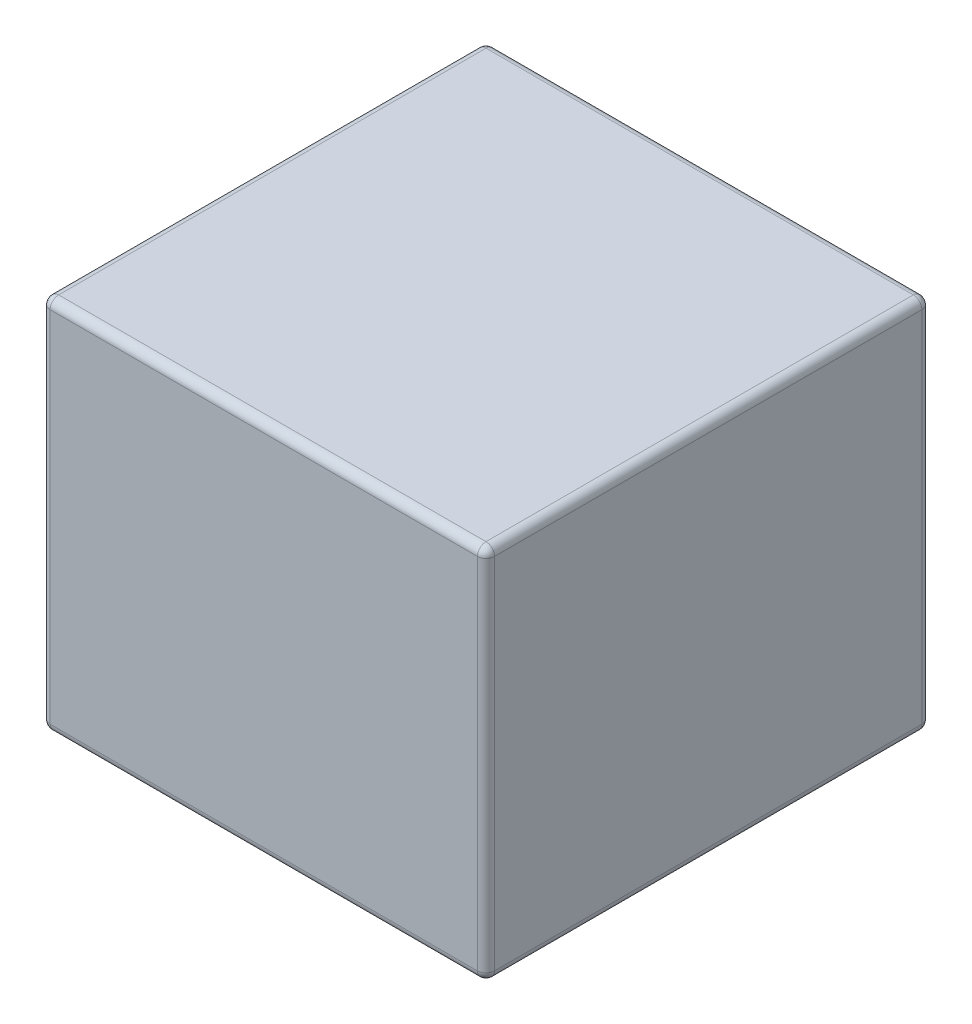
from build123d import *

# Parameters (mm, degrees)
SKETCH1_W           = 330.2
SKETCH1_H           = 330.2
BOSS_EXTRUDE1_DEPTH = 279.4
FILLET1_R           = 6.35


with BuildPart() as part:
    # Sketch1 → Boss-Extrude1 (new body)
    with BuildSketch(Plane(origin=(0, 0, 0), x_dir=(1, 0, 0), z_dir=(0, 1, 0))):
        Rectangle(SKETCH1_W, SKETCH1_H)
    extrude(amount=BOSS_EXTRUDE1_DEPTH)

    # Fillet1
    fillet1_edges = [part.edges().sort_by_distance(p)[0] for p in [
        (-165.1, 279.4, 0),
        (0, 279.4, 165.1),
        (165.1, 279.4, 0),
        (0, 0, 165.1),
        (-165.1, 0, 0),
        (0, 0, -165.1),
        (165.1, 0, 0),
        (0, 279.4, -165.1),
        (165.1, 139.7, 165.1),
        (-165.1, 139.7, 165.1),
        (-165.1, 139.7, -165.1),
        (165.1, 139.7, -165.1),
    ]]
    fillet(fillet1_edges, radius=FILLET1_R)


solid = part.part
